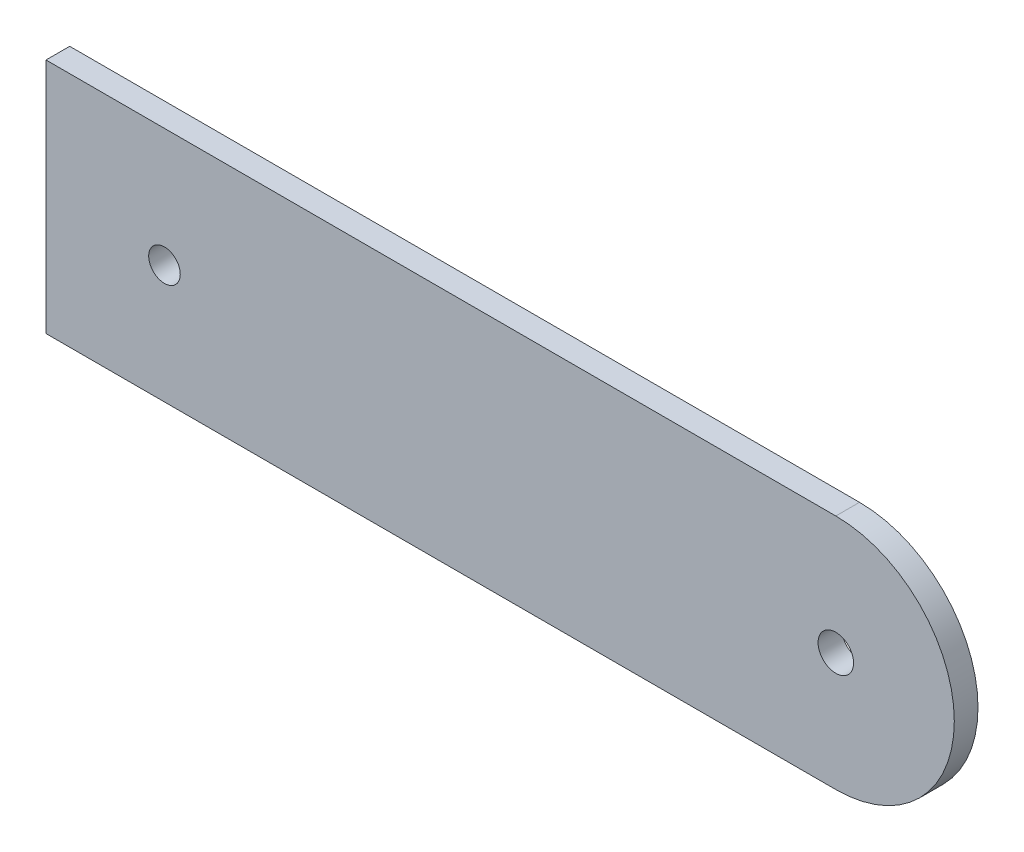
from build123d import *

# Parameters (mm, degrees)
CROQUIS1_R              = 2
CROQUIS1_R_2            = 2.25
SALIENTE_EXTRUIR2_DEPTH = 3


with BuildPart() as part:
    # Croquis1 → Saliente-Extruir2 (new body)
    with BuildSketch(Plane.XY):
        with BuildLine():
            Line((0, 0), (100, 0))
            ThreePointArc((100, 0), (115, 15), (100, 30))
            Line((100, 30), (0, 30))
            Line((0, 30), (0, 0))
        make_face()
        with Locations((15, 15)):
            Circle(CROQUIS1_R, mode=Mode.SUBTRACT)
        with Locations((100, 15)):
            Circle(CROQUIS1_R_2, mode=Mode.SUBTRACT)
    extrude(amount=SALIENTE_EXTRUIR2_DEPTH)


solid = part.part
